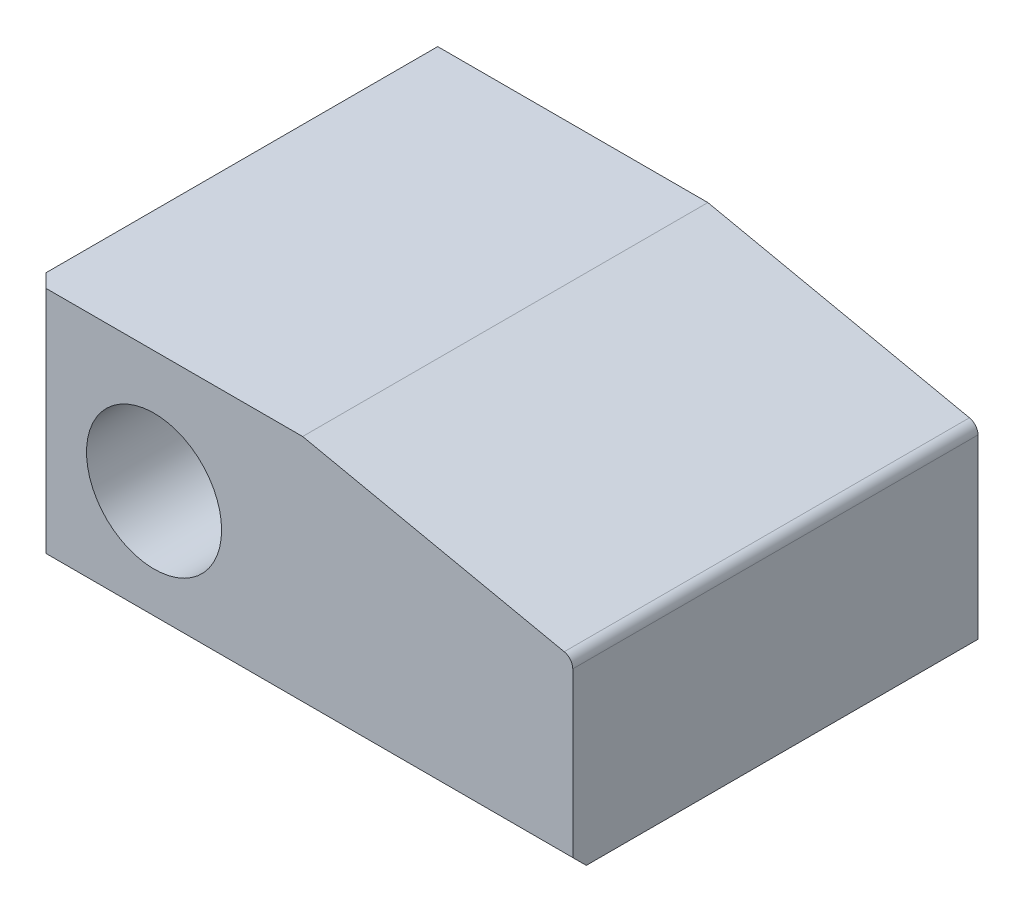
from build123d import *

# Parameters (mm, degrees)
SKETCH1_R           = 2.5
BOSS_EXTRUDE1_DEPTH = 15
FILLET1_R           = 0.4
CHAMFER2_SIZE       = 0.5


with BuildPart() as part:
    # Sketch1 → Boss-Extrude1 (new body)
    with BuildSketch(Plane.XY):
        Polygon((5.5, 4.5), (15.5, 2.374434383), (15.5, -4.5), (-4.5, -4.5), (-4.5, 4.5), align=None)
        Circle(SKETCH1_R, mode=Mode.SUBTRACT)
    extrude(amount=BOSS_EXTRUDE1_DEPTH)

    # Fillet1
    fillet1_edges = [part.edges().sort_by_distance(p)[0] for p in [
        (15.5, 2.374434383, 7.5),
    ]]
    fillet(fillet1_edges, radius=FILLET1_R)

    # Chamfer2
    chamfer2_edges = [part.edges().sort_by_distance(p)[0] for p in [
        (-4.5, 0, 15),
        (5.5, -4.5, 15),
    ]]
    chamfer(chamfer2_edges, length=CHAMFER2_SIZE)


solid = part.part
